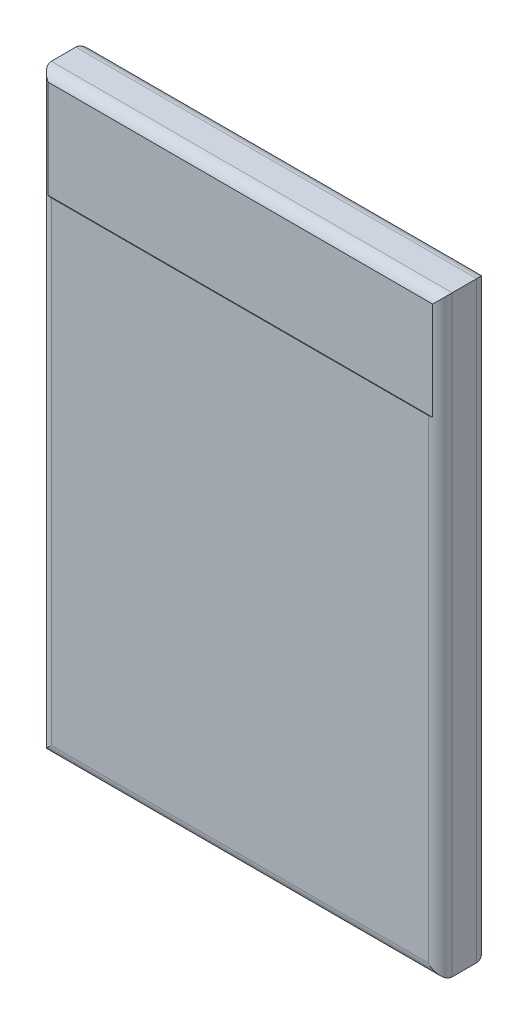
from build123d import *

# Parameters (mm, degrees)
BOSS_EXTRU_1_DEPTH      = 4.05
BOSS_EXTRU_1_DEPTH_BACK = 4.05
ESQUISSE1_W             = 67
ESQUISSE1_H             = 99
CONG_1_R                = 2
ESQUISSE2_W             = 67
ESQUISSE2_H             = 17.754616881
ENL_V_MAT_EXTRU_5_DEPTH = 0.1
ESQUISSE6_W             = 64.2489996
ESQUISSE6_H             = 16.379116681
ENL_V_MAT_EXTRU_6_DEPTH = 0.1
ENL_V_MAT_EXTRU_7_DEPTH = 0.1


with BuildPart() as part:
    # Esquisse1 → Boss.-Extru.1 (new, two sides: drawn at the far end of the back side and taken through both)
    with BuildSketch(Plane.XY.offset(-BOSS_EXTRU_1_DEPTH_BACK)):
        Rectangle(ESQUISSE1_W, ESQUISSE1_H)
    extrude(amount=BOSS_EXTRU_1_DEPTH + BOSS_EXTRU_1_DEPTH_BACK)

    # Congé1
    cong_1_edges = [part.edges().sort_by_distance(p)[0] for p in [
        (33.5, 0, 4.05),
        (-33.5, 0, -4.05),
        (0, 49.5, 4.05),
        (-33.5, 0, 4.05),
        (0, -49.5, 4.05),
        (0, -49.5, -4.05),
        (33.5, 0, -4.05),
        (0, 49.5, -4.05),
    ]]
    fillet(cong_1_edges, radius=CONG_1_R)

    # Esquisse2 → Enlèv. mat.-Extru.5 (cut)
    with BuildSketch(Plane.XY.offset(4.05)):
        with Locations((0, 40.622691559)):
            Rectangle(ESQUISSE2_W, ESQUISSE2_H)
    extrude(amount=-ENL_V_MAT_EXTRU_5_DEPTH, mode=Mode.SUBTRACT)

    # Esquisse6 → Enlèv. mat.-Extru.6 (cut)
    with BuildSketch(Plane(origin=(0, 0, -4.05), x_dir=(-1, 0, 0), z_dir=(0, 0, -1))):
        with Locations((0, 39.93494146)):
            Rectangle(ESQUISSE6_W, ESQUISSE6_H)
    extrude(amount=-ENL_V_MAT_EXTRU_6_DEPTH, mode=Mode.SUBTRACT)

    # Esquisse7 → Enlèv. mat.-Extru.7 (cut)
    # profile 1 of 7: a face of its own
    with BuildSketch(Plane(origin=(0, 0, -4.05), x_dir=(-1, 0, 0), z_dir=(0, 0, -1))):
        with BuildLine():
            Line((-10.961463681, 25.219197497), (-10.719576662, 25.02919349))
            Line((-10.719576662, 25.02919349), (-11.644356309, 23.61503083))
            add(Edge.make_bspline(
                [(-11.644356309, 23.61503083), (-11.582786032, 23.624844691), (-11.462686245, 23.643987736), (-11.341120347, 23.647145681), (-11.281876341, 23.648684676)],
                knots=[0, 0, 0, 0, 1.025318673, 2, 2, 2, 2], degree=3))
            add(Edge.make_bspline(
                [(-11.281876341, 23.648684676), (-11.246303845, 23.647728565), (-11.176280444, 23.645846487), (-11.073473642, 23.631362637), (-10.974684706, 23.608537525), (-10.880323094, 23.575265269), (-10.790050112, 23.532762914), (-10.703347716, 23.481824044), (-10.621845706, 23.419818364), (-10.544494527, 23.350553408), (-10.474267429, 23.273836423), (-10.412091374, 23.192435087), (-10.359864582, 23.106434206), (-10.31749066, 23.01587734), (-10.284585782, 22.92090408), (-10.260598137, 22.821635941), (-10.246418544, 22.718004469), (-10.244493053, 22.647526294), (-10.243514963, 22.611725542)],
                knots=[0, 0, 0, 0, 1.04369286, 2.054478336, 3.041073146, 4.015093852, 4.984733326, 5.965804835, 6.960378782, 7.985147595, 9.009457201, 10.008161701, 10.986880575, 11.956520048, 12.937015923, 13.931873656, 14.949455224, 16, 16, 16, 16], degree=3))
            add(Edge.make_bspline(
                [(-10.243514963, 22.611725542), (-10.244938068, 22.562745838), (-10.247738401, 22.466365372), (-10.275642197, 22.325988665), (-10.319001842, 22.19225615), (-10.380979371, 22.067302979), (-10.457961754, 21.951300409), (-10.551839346, 21.848514944), (-10.659282835, 21.756844906), (-10.780769633, 21.680188287), (-10.911512597, 21.617585236), (-11.048864594, 21.572619994), (-11.191491741, 21.544936525), (-11.288296349, 21.541465922), (-11.337264963, 21.539710317)],
                knots=[0, 0, 0, 0, 1.031375318, 2.029502543, 3.004789286, 3.987476834, 4.960371455, 5.9300674, 6.912260825, 7.929083631, 8.949397511, 9.960523116, 10.96833055, 12, 12, 12, 12], degree=3))
            add(Edge.make_bspline(
                [(-11.337264963, 21.539710317), (-11.384361663, 21.541238523), (-11.477651982, 21.544265631), (-11.614884776, 21.571231569), (-11.746747793, 21.614938672), (-11.872317174, 21.67515295), (-11.988637787, 21.751210833), (-12.092703423, 21.842773112), (-12.183995198, 21.947882577), (-12.259969819, 22.066522925), (-12.320228551, 22.194012882), (-12.365418476, 22.326950039), (-12.391814719, 22.46485002), (-12.395503276, 22.55833116), (-12.397361117, 22.605415446)],
                knots=[0, 0, 0, 0, 1.012016664, 2.004627821, 2.994792927, 3.992885782, 4.990978636, 5.973936114, 6.964471063, 7.975201453, 8.993600317, 9.990122807, 10.98767138, 12, 12, 12, 12], degree=3))
            add(Edge.make_bspline(
                [(-12.397361117, 22.605415446), (-12.396179672, 22.641460029), (-12.393767387, 22.715056181), (-12.376923996, 22.826520209), (-12.349859202, 22.94057129), (-12.319548955, 23.037325484), (-12.287523345, 23.116587006), (-12.260870806, 23.180490497), (-12.22769681, 23.24625157), (-12.192323428, 23.316125206), (-12.151566559, 23.388310639), (-12.10725091, 23.464014308), (-12.058151259, 23.542032236), (-12.023731096, 23.594976431), (-12.006135155, 23.622042048)],
                knots=[0, 0, 0, 0, 1.173818275, 2.396712641, 3.66331629, 4.989737886, 5.693666774, 6.447286557, 7.243889047, 8.091586357, 8.998013824, 9.943181721, 10.948533338, 12, 12, 12, 12], degree=3))
            Line((-12.006135155, 23.622042048), (-10.961463681, 25.219197497))
        make_face()
        with BuildLine():
            add(Edge.make_bspline(
                [(-11.34778179, 23.289710317), (-11.374444035, 23.288932274), (-11.426523144, 23.287412528), (-11.502930559, 23.278587276), (-11.57524381, 23.261968211), (-11.644420944, 23.240801879), (-11.709168647, 23.211698819), (-11.769957487, 23.17634702), (-11.827022538, 23.134725842), (-11.87976609, 23.087424931), (-11.927585754, 23.035636898), (-11.968766884, 22.980167376), (-12.004289284, 22.922353173), (-12.033171103, 22.86171123), (-12.055661179, 22.798264731), (-12.07192943, 22.732305482), (-12.080983181, 22.663391175), (-12.082489413, 22.616658673), (-12.083258553, 22.592795253)],
                knots=[0, 0, 0, 0, 1.129588631, 2.206414736, 3.251139165, 4.268635594, 5.265702196, 6.250456724, 7.242448911, 8.251968645, 9.246821453, 10.222880186, 11.173611482, 12.116736599, 13.062300278, 14.020270554, 14.989073742, 16, 16, 16, 16], degree=3))
            add(Edge.make_bspline(
                [(-12.083258553, 22.592795253), (-12.082632191, 22.569145273), (-12.081403989, 22.522771184), (-12.07025167, 22.454432004), (-12.053216587, 22.388667096), (-12.027876191, 22.325815497), (-11.997649303, 22.264919179), (-11.957743979, 22.208183893), (-11.913527193, 22.152163823), (-11.86067326, 22.101162352), (-11.803949897, 22.053705728), (-11.743348694, 22.012225474), (-11.680188734, 21.976739301), (-11.613617312, 21.948928203), (-11.544578928, 21.926103916), (-11.472498374, 21.910042437), (-11.397325519, 21.900961911), (-11.346403581, 21.899453717), (-11.32043804, 21.898684676)],
                knots=[0, 0, 0, 0, 0.989467248, 1.94019797, 2.891935182, 3.827694429, 4.772920941, 5.730924762, 6.725747692, 7.756678648, 8.79901574, 9.819492441, 10.826891316, 11.826466727, 12.835195252, 13.867842842, 14.912794438, 16, 16, 16, 16], degree=3))
            add(Edge.make_bspline(
                [(-11.32043804, 21.898684676), (-11.294472541, 21.899453778), (-11.243550687, 21.90096209), (-11.168377226, 21.910041758), (-11.096298908, 21.926106406), (-11.027252399, 21.948919177), (-10.960710968, 21.976772786), (-10.897606247, 22.012004706), (-10.837578153, 22.053960824), (-10.780817554, 22.101081252), (-10.728183615, 22.152454104), (-10.682906336, 22.207683826), (-10.644223103, 22.265377722), (-10.612788916, 22.325575612), (-10.587727625, 22.388705099), (-10.570606157, 22.454421823), (-10.559476869, 22.522773849), (-10.558245502, 22.569146174), (-10.557617527, 22.592795253)],
                knots=[0, 0, 0, 0, 1.087397944, 2.132534446, 3.165364764, 4.174271784, 5.174024072, 6.181601208, 7.194203697, 8.236725232, 9.267838612, 10.269026844, 11.221737037, 12.171628256, 13.107553087, 14.05945871, 15.010357665, 16, 16, 16, 16], degree=3))
            add(Edge.make_bspline(
                [(-10.557617527, 22.592795253), (-10.55816782, 22.616689804), (-10.559247866, 22.663587037), (-10.571463815, 22.732274655), (-10.588406189, 22.798599861), (-10.613989219, 22.86214581), (-10.647225764, 22.922661737), (-10.687709171, 22.980453338), (-10.734541741, 23.035963686), (-10.788639281, 23.087526494), (-10.847529515, 23.134673572), (-10.9101451, 23.176293128), (-10.975653074, 23.211418105), (-11.043987016, 23.240725207), (-11.115929899, 23.261874681), (-11.190320238, 23.278527924), (-11.268109481, 23.287389942), (-11.320886089, 23.288927007), (-11.34778179, 23.289710317)],
                knots=[0, 0, 0, 0, 0.978206639, 1.919901502, 2.851605144, 3.780102724, 4.718870031, 5.675451981, 6.667674623, 7.690630536, 8.733308323, 9.756129687, 10.767539656, 11.776269907, 12.797430371, 13.836405707, 14.897401972, 16, 16, 16, 16], degree=3))
        make_face(mode=Mode.SUBTRACT)
    # profile 2 of 7: a face of its own
    with BuildSketch(Plane(origin=(0, 0, -4.05), x_dir=(-1, 0, 0), z_dir=(0, 0, -1))):
        with BuildLine():
            add(Edge.make_bspline(
                [(-9.884540604, 23.378051664), (-9.884212586, 23.434149051), (-9.883575406, 23.543119035), (-9.876486985, 23.701903678), (-9.864711642, 23.850863967), (-9.84857427, 23.990007033), (-9.828936289, 24.119368797), (-9.802720803, 24.238603554), (-9.772908, 24.348263161), (-9.738355554, 24.448705209), (-9.699367765, 24.541282912), (-9.656933505, 24.627708114), (-9.60936871, 24.707850046), (-9.559391797, 24.782987836), (-9.504979726, 24.851891531), (-9.447680935, 24.915534194), (-9.385259059, 24.972444944), (-9.319836051, 25.024291247), (-9.250819586, 25.069740718), (-9.18017692, 25.109773457), (-9.107421814, 25.143973324), (-9.032355631, 25.17086376), (-8.955653073, 25.193074607), (-8.877046007, 25.208263554), (-8.796404643, 25.217820463), (-8.741973208, 25.218734131), (-8.714368328, 25.219197497)],
                knots=[0, 0, 0, 0, 1.646270934, 3.197905019, 4.663502075, 6.030701355, 7.308322542, 8.50163776, 9.611534131, 10.641858119, 11.616356847, 12.558055219, 13.465016945, 14.349605745, 15.204443733, 16.039544428, 16.859896111, 17.680448484, 18.487036065, 19.28249412, 20.06191084, 20.843045899, 21.620316918, 22.403196591, 23.190181807, 24, 24, 24, 24], degree=3))
            add(Edge.make_bspline(
                [(-8.714368328, 25.219197497), (-8.68653285, 25.218709682), (-8.631176841, 25.217739571), (-8.549336466, 25.208415628), (-8.469386784, 25.192944505), (-8.391668645, 25.171023531), (-8.315543659, 25.143827854), (-8.241607251, 25.109740737), (-8.169400169, 25.070061869), (-8.100069882, 25.023437992), (-8.032855267, 24.971455716), (-7.969407304, 24.912693047), (-7.909720218, 24.847743328), (-7.853044912, 24.777301464), (-7.800989315, 24.700016379), (-7.751415883, 24.617232269), (-7.707043847, 24.527501405), (-7.664309172, 24.432320937), (-7.627422185, 24.329057278), (-7.59415594, 24.218292517), (-7.567276971, 24.098718331), (-7.544887699, 23.970962085), (-7.527542803, 23.834554602), (-7.514910161, 23.689788286), (-7.508237076, 23.536567896), (-7.506980375, 23.431810047), (-7.506335476, 23.378051664)],
                knots=[0, 0, 0, 0, 0.810914788, 1.612654377, 2.396697861, 3.181598691, 3.963628158, 4.749916497, 5.551656086, 6.361998678, 7.18212741, 8.025565596, 8.878627764, 9.750805457, 10.657531673, 11.591944965, 12.560506719, 13.57287815, 14.630710178, 15.753379473, 16.941251878, 18.199788006, 19.531962791, 20.947069417, 22.433333509, 24, 24, 24, 24], degree=3))
            add(Edge.make_bspline(
                [(-7.506335476, 23.378051664), (-7.50698706, 23.324527756), (-7.508256646, 23.220238604), (-7.514835353, 23.067707628), (-7.527793984, 22.923709585), (-7.544003972, 22.787899123), (-7.566454935, 22.660841504), (-7.594060102, 22.542097055), (-7.624710424, 22.431152984), (-7.662545219, 22.328918172), (-7.703955929, 22.233966449), (-7.749011125, 22.145299301), (-7.797280951, 22.062133008), (-7.849869696, 21.985133261), (-7.905923109, 21.913754604), (-7.966640898, 21.849256982), (-8.030311483, 21.79008631), (-8.097723899, 21.737434682), (-8.16813545, 21.691349877), (-8.240094527, 21.650136027), (-8.314877911, 21.616903332), (-8.390790863, 21.588368291), (-8.468919229, 21.566567839), (-8.54916562, 21.551493984), (-8.631121856, 21.540922135), (-8.686523421, 21.540115655), (-8.714368328, 21.539710317)],
                knots=[0, 0, 0, 0, 1.561518951, 3.042555995, 4.452378317, 5.7783523, 7.031515105, 8.214008947, 9.334062868, 10.386615937, 11.391082383, 12.354592575, 13.286541444, 14.194233754, 15.072674879, 15.931287219, 16.775624067, 17.606195743, 18.42308326, 19.229000347, 20.022332153, 20.807536673, 21.593273796, 22.3848459, 23.188221202, 24, 24, 24, 24], degree=3))
            add(Edge.make_bspline(
                [(-8.714368328, 21.539710317), (-8.741972442, 21.540176673), (-8.796402367, 21.541096235), (-8.877054792, 21.550609966), (-8.955337236, 21.565905469), (-9.03163599, 21.587322074), (-9.106342505, 21.61353691), (-9.178438792, 21.647690593), (-9.248726475, 21.687024662), (-9.317018031, 21.731820084), (-9.382030192, 21.783141767), (-9.444128798, 21.839906056), (-9.501753817, 21.903529467), (-9.555387912, 21.97300739), (-9.606362001, 22.047700632), (-9.653251374, 22.128629005), (-9.696622228, 22.215471616), (-9.736265719, 22.308789527), (-9.771414382, 22.409944454), (-9.80246209, 22.520093633), (-9.826976248, 22.640209269), (-9.847959203, 22.769326636), (-9.864883586, 22.908000567), (-9.876437911, 23.056306345), (-9.883579226, 23.214151554), (-9.884214297, 23.322421328), (-9.884540604, 23.378051664)],
                knots=[0, 0, 0, 0, 0.810891512, 1.598919785, 2.382837074, 3.152667961, 3.926044502, 4.706494248, 5.493654104, 6.291793342, 7.103789334, 7.925228297, 8.761435821, 9.622817696, 10.50288917, 11.416980706, 12.369136599, 13.353924996, 14.394355917, 15.514179734, 16.714354668, 17.994756427, 19.357759367, 20.818452758, 22.365282078, 24, 24, 24, 24], degree=3))
        make_face()
        with BuildLine():
            add(Edge.make_bspline(
                [(-9.57043804, 23.379453907), (-9.570318593, 23.332705208), (-9.570086769, 23.241975163), (-9.564030569, 23.110131903), (-9.555780337, 22.987161574), (-9.54513904, 22.872908037), (-9.529336091, 22.767758025), (-9.511629303, 22.670988342), (-9.490081214, 22.583111105), (-9.464586196, 22.503523294), (-9.435547099, 22.430874225), (-9.403841235, 22.36327301), (-9.369780512, 22.299921074), (-9.331661362, 22.241387465), (-9.290146299, 22.187481301), (-9.246173039, 22.137248469), (-9.198100455, 22.092451488), (-9.131596713, 22.038724633), (-9.043800238, 21.983205499), (-8.933179783, 21.934859409), (-8.819511332, 21.904476953), (-8.742360082, 21.900613197), (-8.703851501, 21.898684676)],
                knots=[0, 0, 0, 0, 1.459021318, 2.831673884, 4.118529203, 5.306027144, 6.411944654, 7.436330062, 8.375795394, 9.233974572, 10.042671642, 10.816086306, 11.563610507, 12.285937304, 12.993564865, 13.685989202, 14.367179055, 15.041617293, 16.353048772, 17.594441528, 18.799311195, 20, 20, 20, 20], degree=3))
            add(Edge.make_bspline(
                [(-8.703851501, 21.898684676), (-8.66509383, 21.900282457), (-8.587658506, 21.90347472), (-8.474524711, 21.934273457), (-8.364694441, 21.980742997), (-8.278622501, 22.035690502), (-8.213139957, 22.088018832), (-8.166222967, 22.13263348), (-8.123160919, 22.182589347), (-8.082318844, 22.236488643), (-8.044859768, 22.295361127), (-8.010796631, 22.358923703), (-7.979713283, 22.427352881), (-7.962004237, 22.47512262), (-7.952950059, 22.499546055)],
                knots=[0, 0, 0, 0, 1.353760809, 2.704726607, 4.075137775, 5.516104923, 6.260822281, 7.007110065, 7.778089737, 8.566572457, 9.372053459, 10.217411131, 11.088608312, 12, 12, 12, 12], degree=3))
            add(Edge.make_bspline(
                [(-7.952950059, 22.499546055), (-7.942398291, 22.530775794), (-7.920973677, 22.594185558), (-7.893361903, 22.69254921), (-7.871616504, 22.795751974), (-7.852053138, 22.903177091), (-7.838700082, 23.015616792), (-7.827952269, 23.132723176), (-7.821621582, 23.254584538), (-7.820836831, 23.337379529), (-7.82043804, 23.379453907)],
                knots=[0, 0, 0, 0, 0.884706709, 1.796334032, 2.740027952, 3.714592787, 4.726048262, 5.777819803, 6.87074269, 8, 8, 8, 8], degree=3))
            add(Edge.make_bspline(
                [(-7.82043804, 23.379453907), (-7.820988229, 23.42152148), (-7.822064517, 23.503814644), (-7.826178504, 23.624332825), (-7.836802079, 23.738800586), (-7.848601198, 23.847711059), (-7.865998419, 23.950461361), (-7.884756226, 24.047911667), (-7.909957438, 24.138854691), (-7.936877213, 24.224714273), (-7.967687609, 24.304514928), (-8.001603343, 24.378628714), (-8.037825102, 24.447413439), (-8.077167342, 24.51068038), (-8.119163025, 24.568712923), (-8.164920574, 24.620347518), (-8.212624947, 24.667184486), (-8.279442133, 24.720647055), (-8.366916423, 24.775158751), (-8.47576207, 24.82532451), (-8.589032714, 24.854132803), (-8.665606168, 24.85819449), (-8.703851501, 24.860223138)],
                knots=[0, 0, 0, 0, 1.31362396, 2.569729283, 3.763502607, 4.902122613, 5.988968491, 7.01645872, 7.998833611, 8.933434873, 9.825090667, 10.667526885, 11.477055099, 12.250526234, 12.991942729, 13.710640831, 14.402115721, 15.076753259, 16.378508321, 17.609869233, 18.806226677, 20, 20, 20, 20], degree=3))
            add(Edge.make_bspline(
                [(-8.703851501, 24.860223138), (-8.742562093, 24.858191691), (-8.820053799, 24.854125097), (-8.934501754, 24.825431844), (-9.044206105, 24.775418878), (-9.13144908, 24.720466505), (-9.198312867, 24.668128194), (-9.24539556, 24.62274174), (-9.289541732, 24.573095485), (-9.330209432, 24.51869357), (-9.368298715, 24.460228203), (-9.403279728, 24.397239438), (-9.434797058, 24.329408074), (-9.463881594, 24.256791639), (-9.489454382, 24.177210694), (-9.510548345, 24.089441701), (-9.530035398, 23.992979809), (-9.543830667, 23.887260301), (-9.556094423, 23.772978148), (-9.563975771, 23.649700829), (-9.570107028, 23.517636449), (-9.570325493, 23.42643729), (-9.57043804, 23.379453907)],
                knots=[0, 0, 0, 0, 1.207732386, 2.417664972, 3.655092373, 4.956220595, 5.625982001, 6.301752483, 6.994047911, 7.697131622, 8.419323945, 9.170223765, 9.943494443, 10.752040957, 11.610060368, 12.549350801, 13.567764191, 14.679664412, 15.874934091, 17.154273443, 18.533957287, 20, 20, 20, 20], degree=3))
        make_face(mode=Mode.SUBTRACT)
    # profile 3 of 7: a face of its own
    with BuildSketch(Plane(origin=(0, 0, -4.05), x_dir=(-1, 0, 0), z_dir=(0, 0, -1))):
        with BuildLine():
            add(Edge.make_bspline(
                [(-7.192232912, 23.378051664), (-7.191904893, 23.434149051), (-7.191267713, 23.543119035), (-7.184179292, 23.701903678), (-7.17240395, 23.850863967), (-7.156266577, 23.990007033), (-7.136628597, 24.119368797), (-7.11041311, 24.238603554), (-7.080600308, 24.348263161), (-7.046047862, 24.448705209), (-7.007060073, 24.541282912), (-6.964625812, 24.627708114), (-6.917061018, 24.707850046), (-6.867084105, 24.782987836), (-6.812672033, 24.851891531), (-6.755373243, 24.915534194), (-6.692951367, 24.972444944), (-6.627528358, 25.024291247), (-6.558511894, 25.069740718), (-6.487869228, 25.109773457), (-6.415114122, 25.143973324), (-6.340047939, 25.17086376), (-6.263345381, 25.193074607), (-6.184738314, 25.208263554), (-6.104096951, 25.217820463), (-6.049665516, 25.218734131), (-6.022060636, 25.219197497)],
                knots=[0, 0, 0, 0, 1.646270934, 3.197905019, 4.663502075, 6.030701355, 7.308322542, 8.50163776, 9.611534131, 10.641858119, 11.616356847, 12.558055219, 13.465016945, 14.349605745, 15.204443733, 16.039544428, 16.859896111, 17.680448484, 18.487036065, 19.28249412, 20.06191084, 20.843045899, 21.620316918, 22.403196591, 23.190181807, 24, 24, 24, 24], degree=3))
            add(Edge.make_bspline(
                [(-6.022060636, 25.219197497), (-5.994225157, 25.218709682), (-5.938869149, 25.217739571), (-5.857028773, 25.208415628), (-5.777079092, 25.192944505), (-5.699360953, 25.171023531), (-5.623235966, 25.143827854), (-5.549299559, 25.109740737), (-5.477092477, 25.070061869), (-5.40776219, 25.023437992), (-5.340547574, 24.971455716), (-5.277099611, 24.912693047), (-5.217412525, 24.847743328), (-5.16073722, 24.777301464), (-5.108681623, 24.700016379), (-5.059108191, 24.617232269), (-5.014736155, 24.527501405), (-4.972001479, 24.432320937), (-4.935114493, 24.329057278), (-4.901848247, 24.218292517), (-4.874969279, 24.098718331), (-4.852580007, 23.970962085), (-4.835235111, 23.834554602), (-4.822602469, 23.689788286), (-4.815929383, 23.536567896), (-4.814672682, 23.431810047), (-4.814027783, 23.378051664)],
                knots=[0, 0, 0, 0, 0.810914788, 1.612654377, 2.396697861, 3.181598691, 3.963628158, 4.749916497, 5.551656086, 6.361998678, 7.18212741, 8.025565596, 8.878627764, 9.750805457, 10.657531673, 11.591944965, 12.560506719, 13.57287815, 14.630710178, 15.753379473, 16.941251878, 18.199788006, 19.531962791, 20.947069417, 22.433333509, 24, 24, 24, 24], degree=3))
            add(Edge.make_bspline(
                [(-4.814027783, 23.378051664), (-4.814679368, 23.324527756), (-4.815948954, 23.220238604), (-4.822527661, 23.067707628), (-4.835486292, 22.923709585), (-4.85169628, 22.787899123), (-4.874147243, 22.660841504), (-4.901752409, 22.542097055), (-4.932402732, 22.431152984), (-4.970237526, 22.328918172), (-5.011648237, 22.233966449), (-5.056703433, 22.145299301), (-5.104973259, 22.062133008), (-5.157562004, 21.985133261), (-5.213615417, 21.913754604), (-5.274333206, 21.849256982), (-5.338003791, 21.79008631), (-5.405416207, 21.737434682), (-5.475827758, 21.691349877), (-5.547786835, 21.650136027), (-5.622570218, 21.616903332), (-5.698483171, 21.588368291), (-5.776611537, 21.566567839), (-5.856857928, 21.551493984), (-5.938814164, 21.540922135), (-5.994215729, 21.540115655), (-6.022060636, 21.539710317)],
                knots=[0, 0, 0, 0, 1.561518951, 3.042555995, 4.452378317, 5.7783523, 7.031515105, 8.214008947, 9.334062868, 10.386615937, 11.391082383, 12.354592575, 13.286541444, 14.194233754, 15.072674879, 15.931287219, 16.775624067, 17.606195743, 18.42308326, 19.229000347, 20.022332153, 20.807536673, 21.593273796, 22.3848459, 23.188221202, 24, 24, 24, 24], degree=3))
            add(Edge.make_bspline(
                [(-6.022060636, 21.539710317), (-6.04966475, 21.540176673), (-6.104094675, 21.541096235), (-6.1847471, 21.550609966), (-6.263029544, 21.565905469), (-6.339328298, 21.587322074), (-6.414034813, 21.61353691), (-6.486131099, 21.647690593), (-6.556418783, 21.687024662), (-6.624710339, 21.731820084), (-6.6897225, 21.783141767), (-6.751821105, 21.839906056), (-6.809446124, 21.903529467), (-6.86308022, 21.97300739), (-6.914054308, 22.047700632), (-6.960943682, 22.128629005), (-7.004314536, 22.215471616), (-7.043958026, 22.308789527), (-7.07910669, 22.409944454), (-7.110154398, 22.520093633), (-7.134668555, 22.640209269), (-7.155651511, 22.769326636), (-7.172575894, 22.908000567), (-7.184130219, 23.056306345), (-7.191271534, 23.214151554), (-7.191906605, 23.322421328), (-7.192232912, 23.378051664)],
                knots=[0, 0, 0, 0, 0.810891512, 1.598919785, 2.382837074, 3.152667961, 3.926044502, 4.706494248, 5.493654104, 6.291793342, 7.103789334, 7.925228297, 8.761435821, 9.622817696, 10.50288917, 11.416980706, 12.369136599, 13.353924996, 14.394355917, 15.514179734, 16.714354668, 17.994756427, 19.357759367, 20.818452758, 22.365282078, 24, 24, 24, 24], degree=3))
        make_face()
        with BuildLine():
            add(Edge.make_bspline(
                [(-6.878130347, 23.379453907), (-6.8780109, 23.332705208), (-6.877779077, 23.241975163), (-6.871722877, 23.110131903), (-6.863472645, 22.987161574), (-6.852831347, 22.872908037), (-6.837028399, 22.767758025), (-6.819321611, 22.670988342), (-6.797773521, 22.583111105), (-6.772278503, 22.503523294), (-6.743239407, 22.430874225), (-6.711533543, 22.36327301), (-6.67747282, 22.299921074), (-6.639353669, 22.241387465), (-6.597838606, 22.187481301), (-6.553865347, 22.137248469), (-6.505792763, 22.092451488), (-6.43928902, 22.038724633), (-6.351492546, 21.983205499), (-6.240872091, 21.934859409), (-6.12720364, 21.904476953), (-6.05005239, 21.900613197), (-6.011543809, 21.898684676)],
                knots=[0, 0, 0, 0, 1.459021318, 2.831673884, 4.118529203, 5.306027144, 6.411944654, 7.436330062, 8.375795394, 9.233974572, 10.042671642, 10.816086306, 11.563610507, 12.285937304, 12.993564865, 13.685989202, 14.367179055, 15.041617293, 16.353048772, 17.594441528, 18.799311195, 20, 20, 20, 20], degree=3))
            add(Edge.make_bspline(
                [(-6.011543809, 21.898684676), (-5.972786137, 21.900282457), (-5.895350814, 21.90347472), (-5.782217019, 21.934273457), (-5.672386749, 21.980742997), (-5.586314809, 22.035690502), (-5.520832265, 22.088018832), (-5.473915275, 22.13263348), (-5.430853227, 22.182589347), (-5.390011152, 22.236488643), (-5.352552076, 22.295361127), (-5.318488938, 22.358923703), (-5.287405591, 22.427352881), (-5.269696545, 22.47512262), (-5.260642367, 22.499546055)],
                knots=[0, 0, 0, 0, 1.353760809, 2.704726607, 4.075137775, 5.516104923, 6.260822281, 7.007110065, 7.778089737, 8.566572457, 9.372053459, 10.217411131, 11.088608312, 12, 12, 12, 12], degree=3))
            add(Edge.make_bspline(
                [(-5.260642367, 22.499546055), (-5.250090599, 22.530775794), (-5.228665985, 22.594185558), (-5.201054211, 22.69254921), (-5.179308812, 22.795751974), (-5.159745446, 22.903177091), (-5.14639239, 23.015616792), (-5.135644577, 23.132723176), (-5.12931389, 23.254584538), (-5.128529139, 23.337379529), (-5.128130347, 23.379453907)],
                knots=[0, 0, 0, 0, 0.884706709, 1.796334032, 2.740027952, 3.714592787, 4.726048262, 5.777819803, 6.87074269, 8, 8, 8, 8], degree=3))
            add(Edge.make_bspline(
                [(-5.128130347, 23.379453907), (-5.128680537, 23.42152148), (-5.129756824, 23.503814644), (-5.133870812, 23.624332825), (-5.144494387, 23.738800586), (-5.156293506, 23.847711059), (-5.173690727, 23.950461361), (-5.192448533, 24.047911667), (-5.217649746, 24.138854691), (-5.244569521, 24.224714273), (-5.275379916, 24.304514928), (-5.309295651, 24.378628714), (-5.345517409, 24.447413439), (-5.38485965, 24.51068038), (-5.426855333, 24.568712923), (-5.472612882, 24.620347518), (-5.520317255, 24.667184486), (-5.587134441, 24.720647055), (-5.67460873, 24.775158751), (-5.783454378, 24.82532451), (-5.896725022, 24.854132803), (-5.973298476, 24.85819449), (-6.011543809, 24.860223138)],
                knots=[0, 0, 0, 0, 1.31362396, 2.569729283, 3.763502607, 4.902122613, 5.988968491, 7.01645872, 7.998833611, 8.933434873, 9.825090667, 10.667526885, 11.477055099, 12.250526234, 12.991942729, 13.710640831, 14.402115721, 15.076753259, 16.378508321, 17.609869233, 18.806226677, 20, 20, 20, 20], degree=3))
            add(Edge.make_bspline(
                [(-6.011543809, 24.860223138), (-6.050254401, 24.858191691), (-6.127746107, 24.854125097), (-6.242194061, 24.825431844), (-6.351898413, 24.775418878), (-6.439141388, 24.720466505), (-6.506005174, 24.668128194), (-6.553087868, 24.62274174), (-6.59723404, 24.573095485), (-6.63790174, 24.51869357), (-6.675991023, 24.460228203), (-6.710972036, 24.397239438), (-6.742489365, 24.329408074), (-6.771573902, 24.256791639), (-6.79714669, 24.177210694), (-6.818240653, 24.089441701), (-6.837727706, 23.992979809), (-6.851522975, 23.887260301), (-6.863786731, 23.772978148), (-6.871668079, 23.649700829), (-6.877799336, 23.517636449), (-6.8780178, 23.42643729), (-6.878130347, 23.379453907)],
                knots=[0, 0, 0, 0, 1.207732386, 2.417664972, 3.655092373, 4.956220595, 5.625982001, 6.301752483, 6.994047911, 7.697131622, 8.419323945, 9.170223765, 9.943494443, 10.752040957, 11.610060368, 12.549350801, 13.567764191, 14.679664412, 15.874934091, 17.154273443, 18.533957287, 20, 20, 20, 20], degree=3))
        make_face(mode=Mode.SUBTRACT)
    # profile 4 of 7: a face of its own
    with BuildSketch(Plane(origin=(0, 0, -4.05), x_dir=(-1, 0, 0), z_dir=(0, 0, -1))):
        with BuildLine():
            add(Edge.make_bspline(
                [(-4.499925219, 23.378051664), (-4.499597201, 23.434149051), (-4.498960021, 23.543119035), (-4.4918716, 23.701903678), (-4.480096258, 23.850863967), (-4.463958885, 23.990007033), (-4.444320905, 24.119368797), (-4.418105418, 24.238603554), (-4.388292616, 24.348263161), (-4.35374017, 24.448705209), (-4.314752381, 24.541282912), (-4.27231812, 24.627708114), (-4.224753326, 24.707850046), (-4.174776413, 24.782987836), (-4.120364341, 24.851891531), (-4.063065551, 24.915534194), (-4.000643674, 24.972444944), (-3.935220666, 25.024291247), (-3.866204202, 25.069740718), (-3.795561535, 25.109773457), (-3.72280643, 25.143973324), (-3.647740247, 25.17086376), (-3.571037689, 25.193074607), (-3.492430622, 25.208263554), (-3.411789258, 25.217820463), (-3.357357823, 25.218734131), (-3.329752944, 25.219197497)],
                knots=[0, 0, 0, 0, 1.646270934, 3.197905019, 4.663502075, 6.030701355, 7.308322542, 8.50163776, 9.611534131, 10.641858119, 11.616356847, 12.558055219, 13.465016945, 14.349605745, 15.204443733, 16.039544428, 16.859896111, 17.680448484, 18.487036065, 19.28249412, 20.06191084, 20.843045899, 21.620316918, 22.403196591, 23.190181807, 24, 24, 24, 24], degree=3))
            add(Edge.make_bspline(
                [(-3.329752944, 25.219197497), (-3.301917465, 25.218709682), (-3.246561456, 25.217739571), (-3.164721081, 25.208415628), (-3.084771399, 25.192944505), (-3.007053261, 25.171023531), (-2.930928274, 25.143827854), (-2.856991866, 25.109740737), (-2.784784785, 25.070061869), (-2.715454497, 25.023437992), (-2.648239882, 24.971455716), (-2.584791919, 24.912693047), (-2.525104833, 24.847743328), (-2.468429528, 24.777301464), (-2.41637393, 24.700016379), (-2.366800498, 24.617232269), (-2.322428462, 24.527501405), (-2.279693787, 24.432320937), (-2.2428068, 24.329057278), (-2.209540555, 24.218292517), (-2.182661587, 24.098718331), (-2.160272314, 23.970962085), (-2.142927418, 23.834554602), (-2.130294776, 23.689788286), (-2.123621691, 23.536567896), (-2.12236499, 23.431810047), (-2.121720091, 23.378051664)],
                knots=[0, 0, 0, 0, 0.810914788, 1.612654377, 2.396697861, 3.181598691, 3.963628158, 4.749916497, 5.551656086, 6.361998678, 7.18212741, 8.025565596, 8.878627764, 9.750805457, 10.657531673, 11.591944965, 12.560506719, 13.57287815, 14.630710178, 15.753379473, 16.941251878, 18.199788006, 19.531962791, 20.947069417, 22.433333509, 24, 24, 24, 24], degree=3))
            add(Edge.make_bspline(
                [(-2.121720091, 23.378051664), (-2.122371676, 23.324527756), (-2.123641262, 23.220238604), (-2.130219968, 23.067707628), (-2.143178599, 22.923709585), (-2.159388588, 22.787899123), (-2.181839551, 22.660841504), (-2.209444717, 22.542097055), (-2.24009504, 22.431152984), (-2.277929834, 22.328918172), (-2.319340544, 22.233966449), (-2.36439574, 22.145299301), (-2.412665567, 22.062133008), (-2.465254312, 21.985133261), (-2.521307725, 21.913754604), (-2.582025514, 21.849256982), (-2.645696099, 21.79008631), (-2.713108514, 21.737434682), (-2.783520066, 21.691349877), (-2.855479143, 21.650136027), (-2.930262526, 21.616903332), (-3.006175479, 21.588368291), (-3.084303845, 21.566567839), (-3.164550235, 21.551493984), (-3.246506471, 21.540922135), (-3.301908036, 21.540115655), (-3.329752944, 21.539710317)],
                knots=[0, 0, 0, 0, 1.561518951, 3.042555995, 4.452378317, 5.7783523, 7.031515105, 8.214008947, 9.334062868, 10.386615937, 11.391082383, 12.354592575, 13.286541444, 14.194233754, 15.072674879, 15.931287219, 16.775624067, 17.606195743, 18.42308326, 19.229000347, 20.022332153, 20.807536673, 21.593273796, 22.3848459, 23.188221202, 24, 24, 24, 24], degree=3))
            add(Edge.make_bspline(
                [(-3.329752944, 21.539710317), (-3.357357058, 21.540176673), (-3.411786982, 21.541096235), (-3.492439408, 21.550609966), (-3.570721851, 21.565905469), (-3.647020605, 21.587322074), (-3.72172712, 21.61353691), (-3.793823407, 21.647690593), (-3.864111091, 21.687024662), (-3.932402647, 21.731820084), (-3.997414808, 21.783141767), (-4.059513413, 21.839906056), (-4.117138432, 21.903529467), (-4.170772528, 21.97300739), (-4.221746616, 22.047700632), (-4.268635989, 22.128629005), (-4.312006843, 22.215471616), (-4.351650334, 22.308789527), (-4.386798998, 22.409944454), (-4.417846706, 22.520093633), (-4.442360863, 22.640209269), (-4.463343818, 22.769326636), (-4.480268202, 22.908000567), (-4.491822527, 23.056306345), (-4.498963842, 23.214151554), (-4.499598912, 23.322421328), (-4.499925219, 23.378051664)],
                knots=[0, 0, 0, 0, 0.810891512, 1.598919785, 2.382837074, 3.152667961, 3.926044502, 4.706494248, 5.493654104, 6.291793342, 7.103789334, 7.925228297, 8.761435821, 9.622817696, 10.50288917, 11.416980706, 12.369136599, 13.353924996, 14.394355917, 15.514179734, 16.714354668, 17.994756427, 19.357759367, 20.818452758, 22.365282078, 24, 24, 24, 24], degree=3))
        make_face()
        with BuildLine():
            add(Edge.make_bspline(
                [(-4.185822655, 23.379453907), (-4.185703208, 23.332705208), (-4.185471385, 23.241975163), (-4.179415184, 23.110131903), (-4.171164952, 22.987161574), (-4.160523655, 22.872908037), (-4.144720706, 22.767758025), (-4.127013919, 22.670988342), (-4.105465829, 22.583111105), (-4.079970811, 22.503523294), (-4.050931714, 22.430874225), (-4.019225851, 22.36327301), (-3.985165128, 22.299921074), (-3.947045977, 22.241387465), (-3.905530914, 22.187481301), (-3.861557655, 22.137248469), (-3.813485071, 22.092451488), (-3.746981328, 22.038724633), (-3.659184854, 21.983205499), (-3.548564398, 21.934859409), (-3.434895947, 21.904476953), (-3.357744697, 21.900613197), (-3.319236117, 21.898684676)],
                knots=[0, 0, 0, 0, 1.459021318, 2.831673884, 4.118529203, 5.306027144, 6.411944654, 7.436330062, 8.375795394, 9.233974572, 10.042671642, 10.816086306, 11.563610507, 12.285937304, 12.993564865, 13.685989202, 14.367179055, 15.041617293, 16.353048772, 17.594441528, 18.799311195, 20, 20, 20, 20], degree=3))
            add(Edge.make_bspline(
                [(-3.319236117, 21.898684676), (-3.280478445, 21.900282457), (-3.203043122, 21.90347472), (-3.089909327, 21.934273457), (-2.980079057, 21.980742997), (-2.894007116, 22.035690502), (-2.828524573, 22.088018832), (-2.781607583, 22.13263348), (-2.738545534, 22.182589347), (-2.697703459, 22.236488643), (-2.660244384, 22.295361127), (-2.626181246, 22.358923703), (-2.595097899, 22.427352881), (-2.577388853, 22.47512262), (-2.568334674, 22.499546055)],
                knots=[0, 0, 0, 0, 1.353760809, 2.704726607, 4.075137775, 5.516104923, 6.260822281, 7.007110065, 7.778089737, 8.566572457, 9.372053459, 10.217411131, 11.088608312, 12, 12, 12, 12], degree=3))
            add(Edge.make_bspline(
                [(-2.568334674, 22.499546055), (-2.557782907, 22.530775794), (-2.536358293, 22.594185558), (-2.508746518, 22.69254921), (-2.487001119, 22.795751974), (-2.467437754, 22.903177091), (-2.454084698, 23.015616792), (-2.443336884, 23.132723176), (-2.437006197, 23.254584538), (-2.436221446, 23.337379529), (-2.435822655, 23.379453907)],
                knots=[0, 0, 0, 0, 0.884706709, 1.796334032, 2.740027952, 3.714592787, 4.726048262, 5.777819803, 6.87074269, 8, 8, 8, 8], degree=3))
            add(Edge.make_bspline(
                [(-2.435822655, 23.379453907), (-2.436372844, 23.42152148), (-2.437449132, 23.503814644), (-2.44156312, 23.624332825), (-2.452186694, 23.738800586), (-2.463985813, 23.847711059), (-2.481383034, 23.950461361), (-2.500140841, 24.047911667), (-2.525342053, 24.138854691), (-2.552261828, 24.224714273), (-2.583072224, 24.304514928), (-2.616987958, 24.378628714), (-2.653209717, 24.447413439), (-2.692551957, 24.51068038), (-2.734547641, 24.568712923), (-2.78030519, 24.620347518), (-2.828009563, 24.667184486), (-2.894826748, 24.720647055), (-2.982301038, 24.775158751), (-3.091146685, 24.82532451), (-3.20441733, 24.854132803), (-3.280990784, 24.85819449), (-3.319236117, 24.860223138)],
                knots=[0, 0, 0, 0, 1.31362396, 2.569729283, 3.763502607, 4.902122613, 5.988968491, 7.01645872, 7.998833611, 8.933434873, 9.825090667, 10.667526885, 11.477055099, 12.250526234, 12.991942729, 13.710640831, 14.402115721, 15.076753259, 16.378508321, 17.609869233, 18.806226677, 20, 20, 20, 20], degree=3))
            add(Edge.make_bspline(
                [(-3.319236117, 24.860223138), (-3.357946709, 24.858191691), (-3.435438414, 24.854125097), (-3.549886369, 24.825431844), (-3.659590721, 24.775418878), (-3.746833695, 24.720466505), (-3.813697482, 24.668128194), (-3.860780175, 24.62274174), (-3.904926348, 24.573095485), (-3.945594048, 24.51869357), (-3.983683331, 24.460228203), (-4.018664343, 24.397239438), (-4.050181673, 24.329408074), (-4.079266209, 24.256791639), (-4.104838997, 24.177210694), (-4.125932961, 24.089441701), (-4.145420014, 23.992979809), (-4.159215283, 23.887260301), (-4.171479038, 23.772978148), (-4.179360386, 23.649700829), (-4.185491644, 23.517636449), (-4.185710108, 23.42643729), (-4.185822655, 23.379453907)],
                knots=[0, 0, 0, 0, 1.207732386, 2.417664972, 3.655092373, 4.956220595, 5.625982001, 6.301752483, 6.994047911, 7.697131622, 8.419323945, 9.170223765, 9.943494443, 10.752040957, 11.610060368, 12.549350801, 13.567764191, 14.679664412, 15.874934091, 17.154273443, 18.533957287, 20, 20, 20, 20], degree=3))
        make_face(mode=Mode.SUBTRACT)
    # profile 5 of 7: a face of its own
    with BuildSketch(Plane(origin=(0, 0, -4.05), x_dir=(-1, 0, 0), z_dir=(0, 0, -1))):
        with BuildLine():
            Line((-0.237104706, 24.187146215), (0.076997858, 24.187146215))
            Line((0.076997858, 24.187146215), (0.076997858, 23.742634997))
            add(Edge.make_bspline(
                [(0.076997858, 23.742634997), (0.105281808, 23.781522599), (0.159476567, 23.856034972), (0.24834222, 23.954225256), (0.337118332, 24.037553411), (0.401051714, 24.081296282), (0.431765486, 24.102310478)],
                knots=[0, 0, 0, 0, 1.134379233, 2.173579362, 3.122582517, 4, 4, 4, 4], degree=3))
            add(Edge.make_bspline(
                [(0.431765486, 24.102310478), (0.473630148, 24.122315843), (0.556628048, 24.161977056), (0.688047273, 24.202210615), (0.822521942, 24.226935716), (0.913330156, 24.23031709), (0.959009076, 24.23201801)],
                knots=[0, 0, 0, 0, 1.014936303, 2.012140481, 3.000054389, 4, 4, 4, 4], degree=3))
            add(Edge.make_bspline(
                [(0.959009076, 24.23201801), (0.989902072, 24.230972719), (1.051037651, 24.228904145), (1.141621741, 24.215444109), (1.229480353, 24.192177936), (1.314094382, 24.159770612), (1.393815062, 24.120523926), (1.46690426, 24.074474218), (1.532528468, 24.022777142), (1.590654519, 23.963098209), (1.642923544, 23.893761611), (1.691002391, 23.812897362), (1.735427603, 23.718689701), (1.760048912, 23.65032316), (1.773011479, 23.614329708)],
                knots=[0, 0, 0, 0, 1.009824226, 1.998387844, 2.986035974, 3.974953746, 4.955485308, 5.885931332, 6.793869504, 7.679848016, 8.601185859, 9.625726857, 10.749998409, 12, 12, 12, 12], degree=3))
            add(Edge.make_bspline(
                [(1.773011479, 23.614329708), (1.786722731, 23.639054128), (1.813704548, 23.687708313), (1.859010185, 23.756566575), (1.906477981, 23.820973367), (1.956512475, 23.880979791), (2.008937061, 23.936289521), (2.063998462, 23.987085423), (2.121383243, 24.033585637), (2.201175483, 24.087908796), (2.30498809, 24.145609978), (2.435876205, 24.195638422), (2.572026377, 24.22655455), (2.664444075, 24.230184823), (2.711112441, 24.23201801)],
                knots=[0, 0, 0, 0, 0.86119277, 1.694706429, 2.50939023, 3.298075842, 4.073795165, 4.829715201, 5.57930267, 6.321991688, 7.768977793, 9.186738141, 10.579381044, 12, 12, 12, 12], degree=3))
            add(Edge.make_bspline(
                [(2.711112441, 24.23201801), (2.753993904, 24.230400789), (2.83791709, 24.227235731), (2.960094356, 24.202382257), (3.074036161, 24.15970461), (3.179513237, 24.101470974), (3.274673051, 24.02829179), (3.35738936, 23.941222953), (3.427159723, 23.84088033), (3.472738363, 23.746488341), (3.503653627, 23.663153008), (3.522714861, 23.592146717), (3.539554557, 23.513995164), (3.553535802, 23.428604902), (3.563754354, 23.335674294), (3.571325069, 23.235355418), (3.576449143, 23.127570307), (3.576811215, 23.053204806), (3.576997858, 23.014870574)],
                knots=[0, 0, 0, 0, 1.209669288, 2.367440248, 3.500751976, 4.631527125, 5.755587489, 6.87532382, 8.007944318, 9.190864318, 9.82315674, 10.514484317, 11.263564316, 12.079023757, 12.955305781, 13.901327259, 14.918167583, 16, 16, 16, 16], degree=3))
            Line((3.576997858, 23.014870574), (3.576997858, 21.629453907))
            Line((3.576997858, 21.629453907), (3.262895294, 21.629453907))
            Line((3.262895294, 21.629453907), (3.262895294, 23.016272817))
            add(Edge.make_bspline(
                [(3.262895294, 23.016272817), (3.262817411, 23.048993391), (3.262667731, 23.111877358), (3.2599741, 23.202129809), (3.254898786, 23.284398167), (3.248964147, 23.358570255), (3.240720338, 23.424819043), (3.230074406, 23.483011462), (3.218796726, 23.533605273), (3.200060735, 23.589691321), (3.170112843, 23.651561531), (3.124495363, 23.718285107), (3.067025257, 23.776365907), (3.0006651, 23.826784224), (2.925116656, 23.867777865), (2.841851933, 23.897053875), (2.751387881, 23.915176753), (2.688765093, 23.916982769), (2.656424941, 23.917915446)],
                knots=[0, 0, 0, 0, 1.253487763, 2.409012846, 3.458416907, 4.410876679, 5.259312806, 6.014470957, 6.676830364, 7.243083969, 8.276244668, 9.299465089, 10.325150304, 11.392391894, 12.482080715, 13.603491619, 14.762376348, 16, 16, 16, 16], degree=3))
            add(Edge.make_bspline(
                [(2.656424941, 23.917915446), (2.616754987, 23.916499288), (2.538352075, 23.913700423), (2.423906589, 23.88512655), (2.313935573, 23.842046299), (2.21172044, 23.779613842), (2.117692649, 23.704805478), (2.036793071, 23.615855882), (1.969960886, 23.515225956), (1.92470691, 23.422079253), (1.896117608, 23.338409809), (1.877240693, 23.265312437), (1.862557301, 23.182230869), (1.848786772, 23.089723379), (1.839799044, 22.987153198), (1.831630672, 22.874994797), (1.827809809, 22.752910838), (1.82727535, 22.668284149), (1.826997858, 22.624345734)],
                knots=[0, 0, 0, 0, 1.090531906, 2.155305635, 3.229839962, 4.33261226, 5.44038871, 6.529323825, 7.629011124, 8.757537029, 9.370236727, 10.061839251, 10.834451254, 11.692844982, 12.636905849, 13.66920014, 14.789842145, 16, 16, 16, 16], degree=3))
            Line((1.826997858, 22.624345734), (1.826997858, 21.629453907))
            Line((1.826997858, 21.629453907), (1.512895294, 21.629453907))
            Line((1.512895294, 21.629453907), (1.512895294, 22.930034837))
            add(Edge.make_bspline(
                [(1.512895294, 22.930034837), (1.512815863, 22.966728155), (1.512663045, 23.037322413), (1.509986728, 23.138556088), (1.504900106, 23.230637168), (1.499019558, 23.313458632), (1.490559379, 23.386869961), (1.480949617, 23.451264719), (1.469601007, 23.50648147), (1.450811122, 23.567044854), (1.422096654, 23.633765777), (1.375908392, 23.704906799), (1.318300812, 23.767174896), (1.250729936, 23.820333645), (1.174724254, 23.864275126), (1.090740853, 23.895934878), (0.99953594, 23.914359167), (0.936658234, 23.916707664), (0.904321576, 23.917915446)],
                knots=[0, 0, 0, 0, 1.320475261, 2.540461679, 3.643808994, 4.639130445, 5.527981419, 6.302341397, 6.981980563, 7.553956391, 8.582137848, 9.585246428, 10.591171744, 11.620968678, 12.668337649, 13.738356861, 14.836885341, 16, 16, 16, 16], degree=3))
            add(Edge.make_bspline(
                [(0.904321576, 23.917915446), (0.866305364, 23.916384986), (0.790540405, 23.913334833), (0.679238435, 23.885880559), (0.571752751, 23.842876484), (0.469798053, 23.783216665), (0.376123904, 23.709317587), (0.294115637, 23.622402691), (0.225173112, 23.523553658), (0.179441297, 23.431389141), (0.149942823, 23.349815866), (0.130347488, 23.280464918), (0.113507862, 23.20346467), (0.10099384, 23.118577559), (0.088913425, 23.026356465), (0.083083116, 22.926341975), (0.077411554, 22.818619888), (0.077139139, 22.744247342), (0.076997858, 22.705675862)],
                knots=[0, 0, 0, 0, 1.098833095, 2.189935336, 3.297829714, 4.440610912, 5.596351641, 6.740013378, 7.886572111, 9.072425424, 9.705826452, 10.395263256, 11.156850408, 11.985370555, 12.878090359, 13.847760091, 14.883794034, 16, 16, 16, 16], degree=3))
            Line((0.076997858, 22.705675862), (0.076997858, 21.629453907))
            Line((0.076997858, 21.629453907), (-0.237104706, 21.629453907))
            Line((-0.237104706, 21.629453907), (-0.237104706, 24.187146215))
        make_face()
    # profile 6 of 7: a face of its own
    with BuildSketch(Plane(origin=(0, 0, -4.05), x_dir=(-1, 0, 0), z_dir=(0, 0, -1))):
        Polygon((5.820587601, 25.129453907), (7.435972217, 21.629453907), (7.094525903, 21.629453907), (6.577098018, 22.751248779), (4.990459396, 22.751248779), (4.458307954, 21.629453907), (4.115459396, 21.629453907), (5.775715806, 25.129453907), align=None)
        Polygon((5.794646095, 24.447262401), (5.160831992, 23.110223138), (6.411633274, 23.110223138), align=None, mode=Mode.SUBTRACT)
    # profile 7 of 7: a face of its own
    with BuildSketch(Plane(origin=(0, 0, -4.05), x_dir=(-1, 0, 0), z_dir=(0, 0, -1))):
        with BuildLine():
            Line((7.974433755, 25.219197497), (8.288536319, 25.219197497))
            Line((8.288536319, 25.219197497), (8.288536319, 23.704073298))
            add(Edge.make_bspline(
                [(8.288536319, 23.704073298), (8.322253621, 23.74621728), (8.387902935, 23.828273773), (8.498399052, 23.935334964), (8.611869924, 24.028133585), (8.732234733, 24.102004042), (8.857285254, 24.160360585), (8.987548898, 24.201748232), (9.12304987, 24.227199329), (9.21507502, 24.230397746), (9.26169337, 24.23201801)],
                knots=[0, 0, 0, 0, 1.125788106, 2.19196713, 3.20547328, 4.180437432, 5.132270164, 6.079753143, 7.027236121, 8, 8, 8, 8], degree=3))
            add(Edge.make_bspline(
                [(9.26169337, 24.23201801), (9.309023763, 24.230272579), (9.401660759, 24.226856351), (9.536542221, 24.19984297), (9.662503096, 24.153685532), (9.779168939, 24.090518507), (9.883993636, 24.01184568), (9.976843401, 23.921014157), (10.052684199, 23.815740239), (10.104283316, 23.718483985), (10.137856724, 23.631945231), (10.15910855, 23.557708719), (10.177127749, 23.474986806), (10.192827485, 23.383822073), (10.203291066, 23.283776902), (10.211695684, 23.175302648), (10.217672138, 23.058405529), (10.217903743, 22.97748528), (10.218023499, 22.935643811)],
                knots=[0, 0, 0, 0, 1.235656852, 2.418478516, 3.575258207, 4.727955599, 5.870717718, 6.98870536, 8.107142894, 9.245821548, 9.854588956, 10.528768408, 11.260415777, 12.065282286, 12.943670737, 13.886611085, 14.907229059, 16, 16, 16, 16], degree=3))
            Line((10.218023499, 22.935643811), (10.218023499, 21.629453907))
            Line((10.218023499, 21.629453907), (9.903920935, 21.629453907))
            Line((9.903920935, 21.629453907), (9.903920935, 22.832578907))
            add(Edge.make_bspline(
                [(9.903920935, 22.832578907), (9.903730631, 22.867401577), (9.903366614, 22.934011417), (9.902163269, 23.029377525), (9.899477054, 23.11587366), (9.895136228, 23.193222612), (9.890570921, 23.261532215), (9.884287604, 23.320703269), (9.87697737, 23.370817045), (9.870408588, 23.400981673), (9.867462601, 23.414509997)],
                knots=[0, 0, 0, 0, 1.430932559, 2.737130458, 3.918967929, 4.986496826, 5.920444988, 6.731744033, 7.431208747, 8, 8, 8, 8], degree=3))
            add(Edge.make_bspline(
                [(9.867462601, 23.414509997), (9.856038356, 23.454204261), (9.834075312, 23.530516251), (9.783027334, 23.634178661), (9.719268323, 23.722563402), (9.641421062, 23.79447769), (9.550862698, 23.850889229), (9.447002733, 23.889957012), (9.330818665, 23.914204734), (9.248967193, 23.916644037), (9.206304749, 23.917915446)],
                knots=[0, 0, 0, 0, 1.090059168, 2.095632401, 3.037101401, 3.955032261, 4.878929692, 5.839099886, 6.873700383, 8, 8, 8, 8], degree=3))
            add(Edge.make_bspline(
                [(9.206304749, 23.917915446), (9.181036976, 23.917439619), (9.131032705, 23.916497971), (9.056884039, 23.907044073), (8.984954976, 23.891595354), (8.914552798, 23.870690815), (8.8471696, 23.842245279), (8.780841275, 23.80931509), (8.717447066, 23.769006835), (8.65586125, 23.723781067), (8.598543716, 23.673711307), (8.545216601, 23.620864352), (8.497678261, 23.564589388), (8.45460967, 23.505789272), (8.417431384, 23.443657479), (8.384978302, 23.37879316), (8.357442605, 23.311111015), (8.343759913, 23.264135953), (8.336913723, 23.240631792)],
                knots=[0, 0, 0, 0, 1.024319606, 2.027102035, 3.025350316, 4.005802111, 5.00026367, 5.987881639, 7.005602596, 8.042517216, 9.083927026, 10.089214625, 11.084353441, 12.06828073, 13.041928858, 14.016821737, 15.00770877, 16, 16, 16, 16], degree=3))
            add(Edge.make_bspline(
                [(8.336913723, 23.240631792), (8.332974296, 23.223610841), (8.324389799, 23.186520094), (8.315074966, 23.12534577), (8.306737169, 23.054259398), (8.299688619, 22.973368798), (8.295365533, 22.882377555), (8.290707292, 22.781906596), (8.288973278, 22.671326575), (8.288686325, 22.594431068), (8.288536319, 22.554233555)],
                knots=[0, 0, 0, 0, 0.607992626, 1.324890765, 2.152360218, 3.099583803, 4.150613268, 5.323148443, 6.60066238, 8, 8, 8, 8], degree=3))
            Line((8.288536319, 22.554233555), (8.288536319, 21.629453907))
            Line((8.288536319, 21.629453907), (7.974433755, 21.629453907))
            Line((7.974433755, 21.629453907), (7.974433755, 25.219197497))
        make_face()
    extrude(amount=-ENL_V_MAT_EXTRU_7_DEPTH, mode=Mode.SUBTRACT)


solid = part.part
